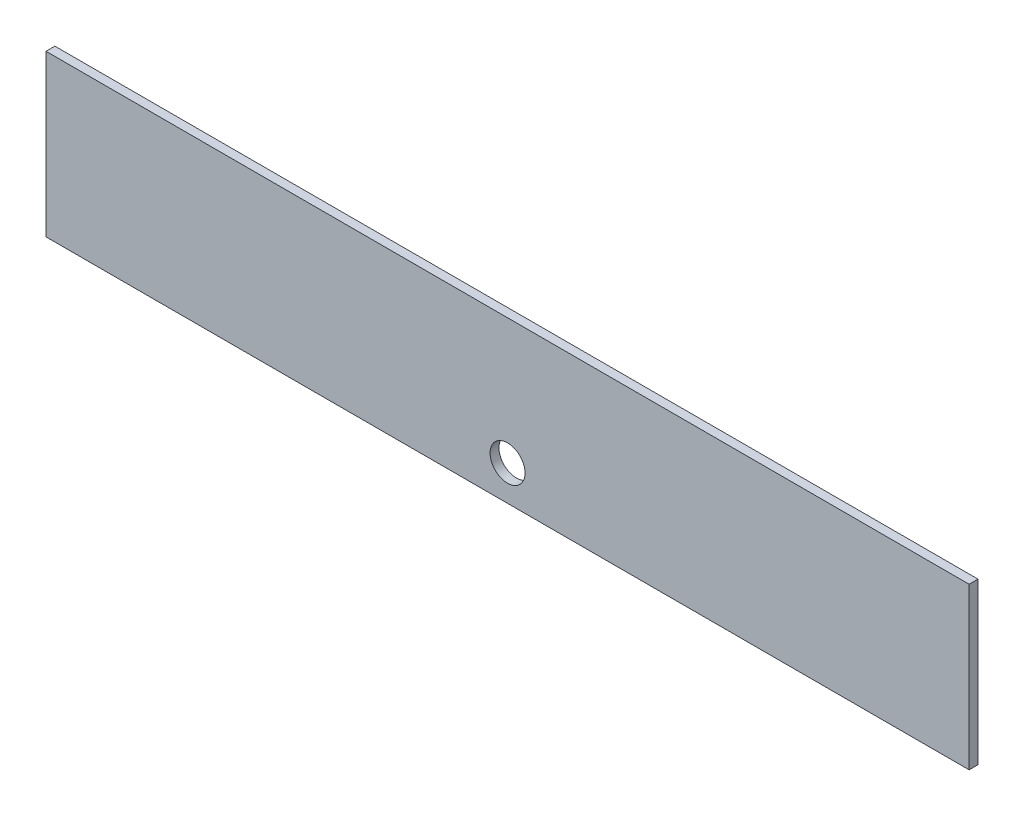
from build123d import *

# Parameters (mm, degrees)
SKETCH1_W           = 660.4
SKETCH1_H           = 115
BOSS_EXTRUDE1_DEPTH = 6.35
SKETCH2_R           = 12.5
CUT_EXTRUDE1_DEPTH  = 343.304487993


with BuildPart() as part:
    # Sketch1 → Boss-Extrude1 (new body)
    with BuildSketch(Plane.XY):
        with Locations((0, 32.5)):
            Rectangle(SKETCH1_W, SKETCH1_H)
    extrude(amount=BOSS_EXTRUDE1_DEPTH)

    # Sketch2 → Cut-Extrude1 (cut, through all)
    with BuildSketch(Plane(origin=(0, 0, 0), x_dir=(-1, 0, 0), z_dir=(0, 0, -1))):
        Circle(SKETCH2_R)
    extrude(amount=-CUT_EXTRUDE1_DEPTH, mode=Mode.SUBTRACT)


solid = part.part
